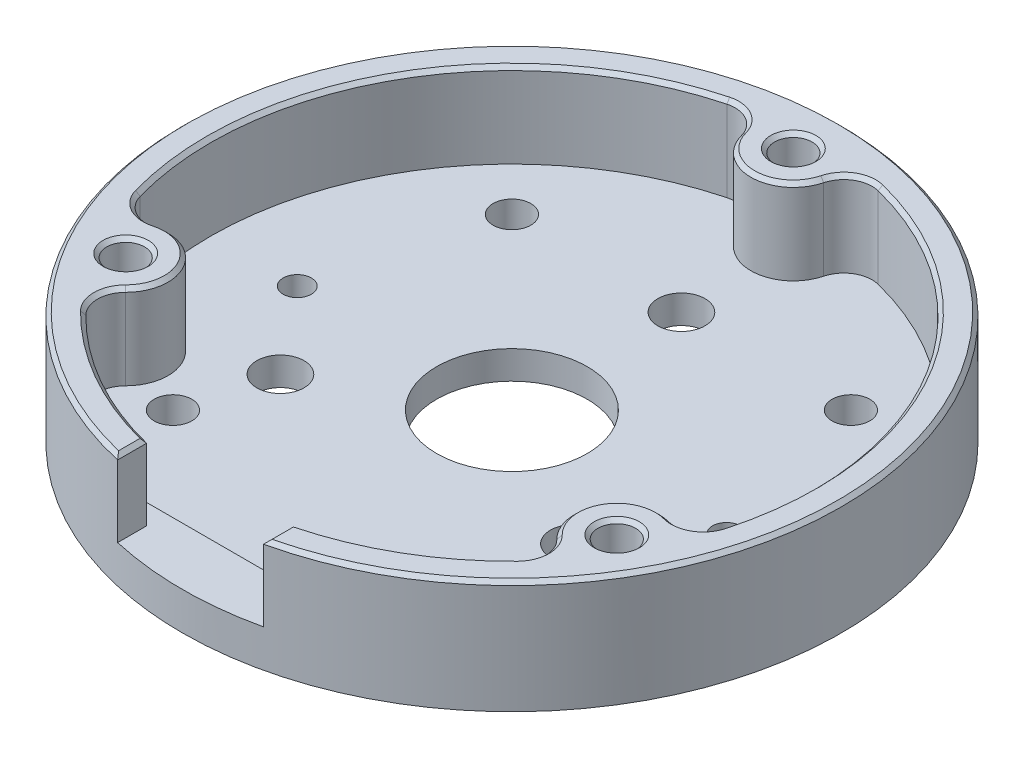
from build123d import *

# Parameters (mm, degrees)
SKETCH_1_R          = 35
SKETCH_1_R_2        = 8
EXTRUDE_1_DEPTH     = 3
SKETCH_2_R          = 35
SKETCH_2_R_2        = 2
EXTRUDE_2_DEPTH     = 9
SKETCH_3_R          = 1.5
CUT_EXTRUDE_1_DEPTH = 8
SKETCH_4_R          = 2.50640253
CUT_EXTRUDE_2_DEPTH = 8
SKETCH_7_R          = 2
CUT_EXTRUDE_4_DEPTH = 12
EXTRUDE_4_DEPTH     = 1
SKETCH_9_W          = 15.497656666
SKETCH_9_H          = 9.48184561
CUT_EXTRUDE_5_DEPTH = 11
CHAMFER_1_SIZE      = 0.4


with BuildPart() as part:
    # Эскиз1 → Бобышка-Вытянуть1 (new body)
    with BuildSketch(Plane(origin=(0, 0, 0), x_dir=(1, 0, 0), z_dir=(0, 1, 0))):
        with Locations(Location((0, 0, 0), (0, 0, 270))):
            Circle(SKETCH_1_R)
        with Locations(Location((0, 0, 0), (0, 0, 270))):
            Circle(SKETCH_1_R_2, mode=Mode.SUBTRACT)
    extrude(amount=EXTRUDE_1_DEPTH)

    # Эскиз2 → Бобышка-Вытянуть2 (add)
    with BuildSketch(Plane(origin=(0, 3, 0), x_dir=(1, 0, 0), z_dir=(0, 1, 0))):
        with Locations(Location((0, 0, 0), (0, 0, 270))):
            Circle(SKETCH_2_R)
        with Locations(Location((-0.113661048, 30, 0), (0, 0, 270))):
            Circle(SKETCH_2_R_2, mode=Mode.SUBTRACT)
        with Locations(Location((26.037592637, -14.901566645, 0), (0, 0, 270))):
            Circle(SKETCH_2_R_2, mode=Mode.SUBTRACT)
        with Locations(Location((-25.92393159, -15.098433355, 0), (0, 0, 270))):
            Circle(SKETCH_2_R_2, mode=Mode.SUBTRACT)
        with BuildLine():
            ThreePointArc((-8.117111797, 30.953392319), (-27.773232815, 15.894890343), (-30.80008796, -8.680701679))
            ThreePointArc((-30.80008796, -8.680701679), (-29.387206086, -10.479447295), (-27.117120464, -10.75950488))
            ThreePointArc((-27.117120464, -10.75950488), (-22.03536976, -12.833684606), (-22.738725961, -18.277185484))
            ThreePointArc((-22.738725961, -18.277185484), (-23.615248532, -20.389868414), (-22.747868184, -22.506321181))
            ThreePointArc((-22.747868184, -22.506321181), (0.121237581, -31.999770334), (22.917752157, -22.333307773))
            ThreePointArc((22.917752157, -22.333307773), (23.769070618, -20.210343369), (22.87656479, -18.10436276))
            ThreePointArc((22.87656479, -18.10436276), (22.131981773, -12.666347691), (27.197869919, -10.55372159))
            ThreePointArc((27.197869919, -10.55372159), (29.465768293, -10.256470938), (30.86497998, -8.447071138))
            ThreePointArc((30.86497998, -8.447071138), (27.651995235, 16.104879992), (7.882335804, 31.014009452))
            ThreePointArc((7.882335804, 31.014009452), (5.618135468, 30.689790665), (4.240555674, 28.863867639))
            ThreePointArc((4.240555674, 28.863867639), (-0.096612013, 25.500032297), (-4.459143958, 28.830907074))
            ThreePointArc((-4.459143958, 28.830907074), (-5.850519761, 30.646339352), (-8.117111797, 30.953392319))
        make_face(mode=Mode.SUBTRACT)
    extrude(amount=EXTRUDE_2_DEPTH)

    # Эскиз3 → Вырез-Вытянуть1 (cut)
    with BuildSketch(Plane(origin=(0, 3, 0), x_dir=(1, 0, 0), z_dir=(0, 1, 0))):
        with Locations(Location((22.8, 0, 0), (0, 0, 270))):
            Circle(SKETCH_3_R)
        with Locations(Location((-22.8, 0, 0), (0, 0, 270))):
            Circle(SKETCH_3_R)
    extrude(amount=-CUT_EXTRUDE_1_DEPTH, mode=Mode.SUBTRACT)

    # Эскиз4 → Вырез-Вытянуть2 (cut)
    with BuildSketch(Plane(origin=(0, 3, 0), x_dir=(1, 0, 0), z_dir=(0, 1, 0))):
        with Locations(Location((0, 18, 0), (0, 0, 270))):
            Circle(SKETCH_4_R)
        with Locations(Location((15.588457268, -9, 0), (0, 0, 270))):
            Circle(SKETCH_4_R)
        with Locations(Location((-15.588457268, -9, 0), (0, 0, 270))):
            Circle(SKETCH_4_R)
    extrude(amount=-CUT_EXTRUDE_2_DEPTH, mode=Mode.SUBTRACT)

    # Эскиз7 → Вырез-Вытянуть4 (cut)
    with BuildSketch(Plane(origin=(0, 3, 0), x_dir=(1, 0, 0), z_dir=(0, 1, 0))):
        with Locations(Location((-18, -18, 0), (0, 0, 270))):
            Circle(SKETCH_7_R)
        with Locations(Location((18, -18, 0), (0, 0, 270))):
            Circle(SKETCH_7_R)
        with Locations(Location((-18, 18, 0), (0, 0, 270))):
            Circle(SKETCH_7_R)
        with Locations(Location((18, 18, 0), (0, 0, 270))):
            Circle(SKETCH_7_R)
    extrude(amount=-CUT_EXTRUDE_4_DEPTH, mode=Mode.SUBTRACT)

    # Эскиз8 → Бобышка-Вытянуть4 (add)
    with BuildSketch(Plane(origin=(0, 3, 0), x_dir=(1, 0, 0), z_dir=(0, 1, 0))):
        with BuildLine():
            Line((-13.748828333, -28.895842598), (13.748828333, -28.895842598))
            ThreePointArc((13.748828333, -28.895842598), (0, -32), (-13.748828333, -28.895842598))
        make_face()
    extrude(amount=EXTRUDE_4_DEPTH)

    # Эскиз9 → Вырез-Вытянуть5 (cut)
    with BuildSketch(Plane(origin=(0, 0, 28.895842598), x_dir=(-1, 0, 0), z_dir=(0, 0, -1))):
        with Locations((0, 8.740922805)):
            Rectangle(SKETCH_9_W, SKETCH_9_H)
    extrude(amount=-CUT_EXTRUDE_5_DEPTH, mode=Mode.SUBTRACT)

    # Фаска1
    chamfer_1_edges = [part.edges().sort_by_distance(p)[0] for p in [
        (15.940347108, 12, 27.747168037),
        (7.748828333, 12, 32.589541055),
        (-7.748828333, 12, 32.589541055),
        (0, 12, -35),
        (-29.387206086, 12, 10.479447295),
        (-22.03536976, 12, 12.833684606),
        (-23.615248532, 12, 20.389868414),
        (-15.835107718, 12, 27.807361679),
        (23.769070618, 12, 20.210343369),
        (22.131981773, 12, 12.666347691),
        (29.465768293, 12, 10.256470938),
        (27.651995235, 12, -16.104879992),
        (5.618135468, 12, -30.689790665),
        (-0.096612013, 12, -25.500032297),
        (-5.850519761, 12, -30.646339352),
        (-27.773232815, 12, -15.894890343),
        (-0.113661048, 12, -32),
        (26.037592637, 12, 12.901566645),
        (-25.92393159, 12, 13.098433355),
    ]]
    chamfer(chamfer_1_edges, length=CHAMFER_1_SIZE)


solid = part.part
